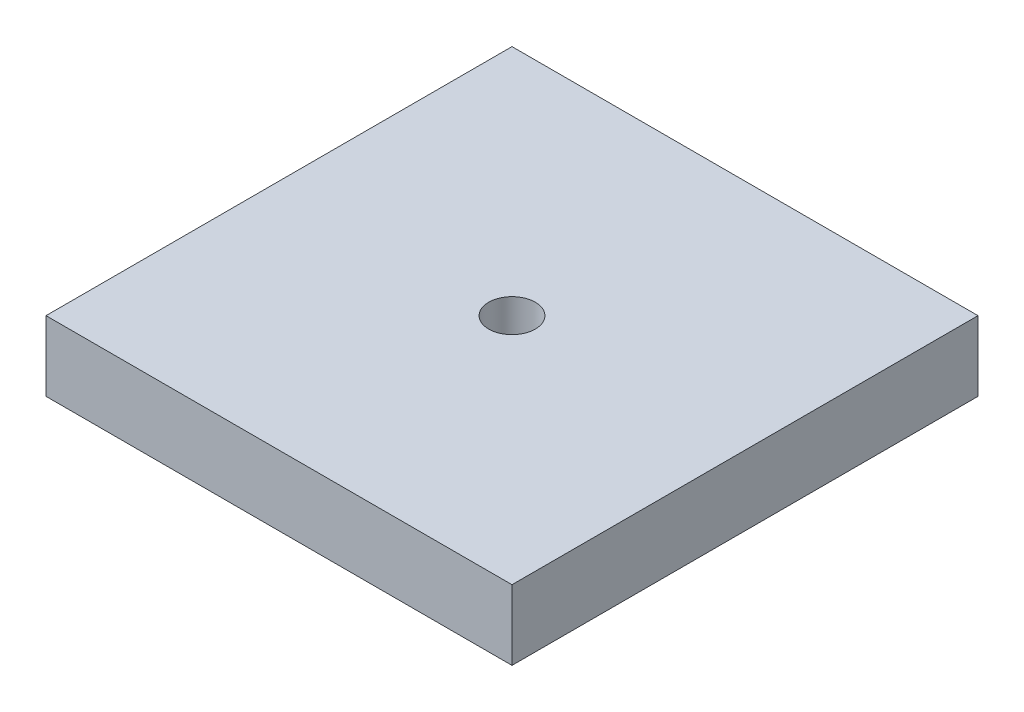
from build123d import *

# Parameters (mm, degrees)
SKETCH1_W           = 254
SKETCH1_H           = 254
SKETCH1_R           = 12.7
BOSS_EXTRUDE2_DEPTH = 38.1


with BuildPart() as part:
    # Sketch1 → Boss-Extrude2 (new body)
    with BuildSketch(Plane(origin=(0, 0, 0), x_dir=(1, 0, 0), z_dir=(0, 1, 0))):
        Rectangle(SKETCH1_W, SKETCH1_H)
        with Locations(Location((0, 0, 0), (0, 0, 90))):
            Circle(SKETCH1_R, mode=Mode.SUBTRACT)
    extrude(amount=BOSS_EXTRUDE2_DEPTH)


solid = part.part
